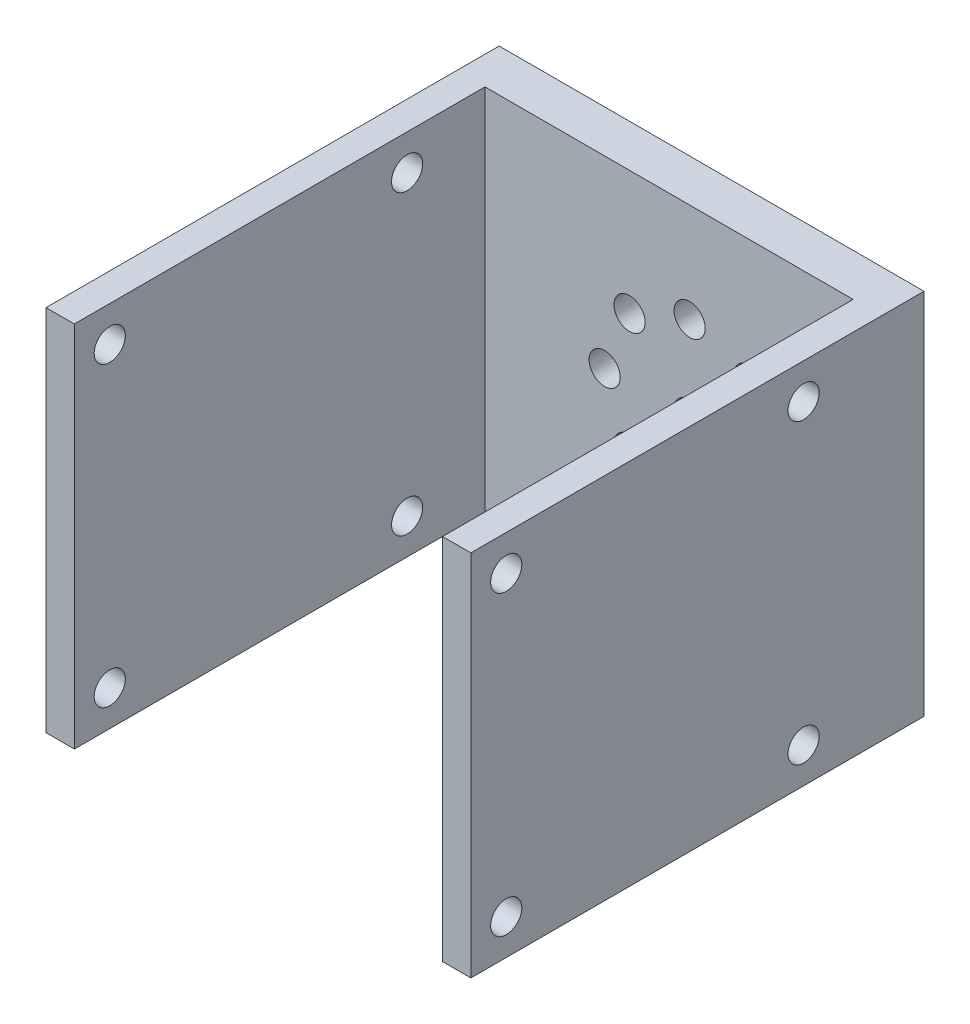
from build123d import *

# Parameters (mm, degrees)
SKETCH_1_W      = 26
SKETCH_1_H      = 26
SKETCH_1_R      = 1.1
EXTRUDE_1_DEPTH = 3
SKETCH_2_W      = 32
SKETCH_2_H      = 26
SKETCH_2_R      = 1.1
EXTRUDE_2_DEPTH = 2
EXTRUDE_START   = 2
SKETCH_3_W      = 32
SKETCH_3_H      = 26
SKETCH_3_R      = 1.1
EXTRUDE_3_DEPTH = 2


with BuildPart() as part:
    # ｽｹｯﾁ1 → ﾎﾞｽ - 押し出し1 (new body)
    with BuildSketch(Plane.XY):
        Rectangle(SKETCH_1_W, SKETCH_1_H)
        with Locations((1.45, 0)):
            Circle(SKETCH_1_R, mode=Mode.SUBTRACT)
        with Locations((1.45, 6)):
            Circle(SKETCH_1_R, mode=Mode.SUBTRACT)
        with Locations((5.692640687, 4.242640687)):
            Circle(SKETCH_1_R, mode=Mode.SUBTRACT)
        with Locations((7.45, 0)):
            Circle(SKETCH_1_R, mode=Mode.SUBTRACT)
        with Locations((5.692640687, -4.242640687)):
            Circle(SKETCH_1_R, mode=Mode.SUBTRACT)
        with Locations((1.45, -6)):
            Circle(SKETCH_1_R, mode=Mode.SUBTRACT)
        with Locations((-2.792640687, -4.242640687)):
            Circle(SKETCH_1_R, mode=Mode.SUBTRACT)
        with Locations((-4.55, 0)):
            Circle(SKETCH_1_R, mode=Mode.SUBTRACT)
        with Locations((-2.792640687, 4.242640687)):
            Circle(SKETCH_1_R, mode=Mode.SUBTRACT)
    extrude(amount=EXTRUDE_1_DEPTH)

    # ｽｹｯﾁ2 → ﾎﾞｽ - 押し出し2 (add)
    with BuildSketch(Plane.ZY.offset(13)):
        with Locations((16, 0)):
            Rectangle(SKETCH_2_W, SKETCH_2_H)
        with Locations((29.5, 10.5)):
            Circle(SKETCH_2_R, mode=Mode.SUBTRACT)
        with Locations((8.5, 10.5)):
            Circle(SKETCH_2_R, mode=Mode.SUBTRACT)
        with Locations((8.5, -10.5)):
            Circle(SKETCH_2_R, mode=Mode.SUBTRACT)
        with Locations((29.5, -10.5)):
            Circle(SKETCH_2_R, mode=Mode.SUBTRACT)
    extrude(amount=EXTRUDE_2_DEPTH)

    # ｽｹｯﾁ3 → ﾎﾞｽ - 押し出し3 (add)
    with BuildSketch(Plane(origin=(13, 0, 0), x_dir=(0, 0, -1), z_dir=(1, 0, 0)).offset(EXTRUDE_START)):
        with Locations((-16, 0)):
            Rectangle(SKETCH_3_W, SKETCH_3_H)
        with Locations(Location((-8.5, -10.5, 0), (0, 0, 180))):
            Circle(SKETCH_3_R, mode=Mode.SUBTRACT)
        with Locations(Location((-8.5, 10.5, 0), (0, 0, 180))):
            Circle(SKETCH_3_R, mode=Mode.SUBTRACT)
        with Locations(Location((-29.5, 10.5, 0), (0, 0, 180))):
            Circle(SKETCH_3_R, mode=Mode.SUBTRACT)
        with Locations(Location((-29.5, -10.5, 0), (0, 0, 180))):
            Circle(SKETCH_3_R, mode=Mode.SUBTRACT)
    extrude(amount=-EXTRUDE_3_DEPTH)


solid = part.part
